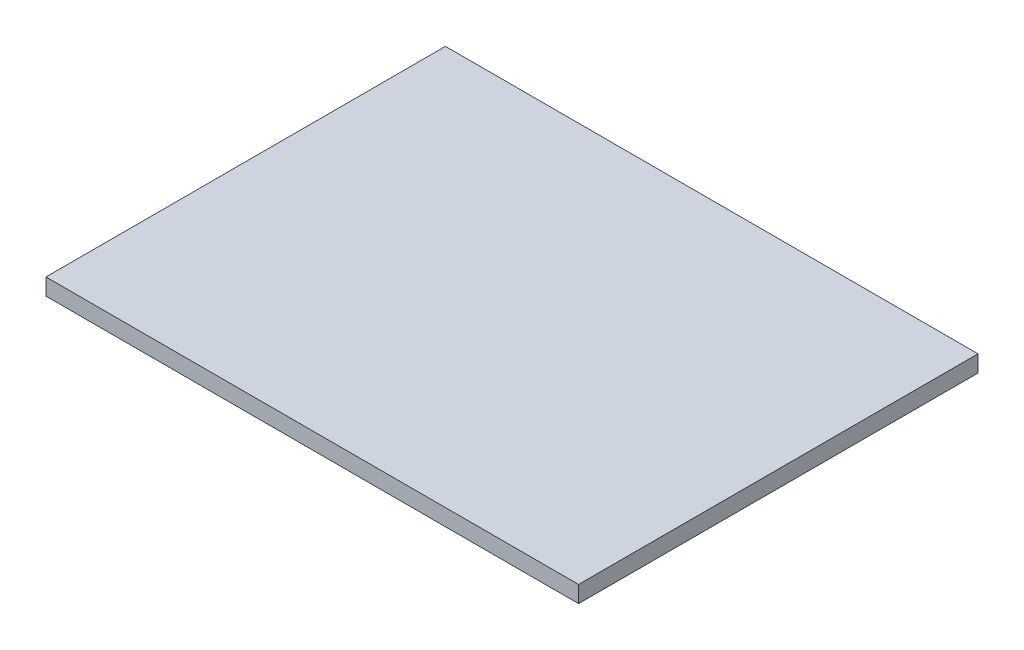
from build123d import *

# Parameters (mm, degrees)
SKETCH1_W           = 203.2
SKETCH1_H           = 152.4
BOSS_EXTRUDE1_DEPTH = 6.35


with BuildPart() as part:
    # Sketch1 → Boss-Extrude1 (new body)
    with BuildSketch(Plane(origin=(0, 0, 0), x_dir=(1, 0, 0), z_dir=(0, 1, 0))):
        Rectangle(SKETCH1_W, SKETCH1_H)
    extrude(amount=BOSS_EXTRUDE1_DEPTH)


solid = part.part
